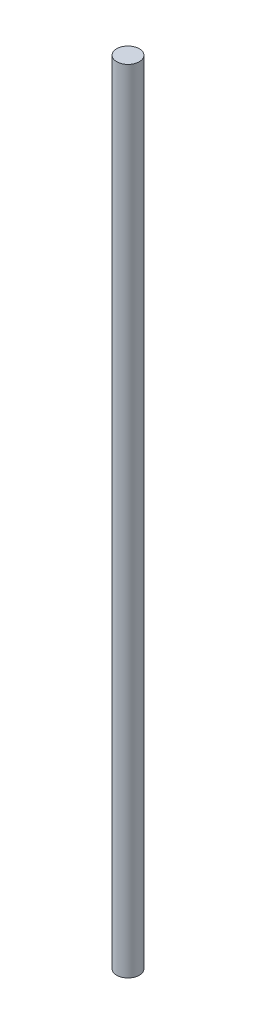
from build123d import *

# Parameters (mm, degrees)
SKETCH2_R           = 4
BOSS_EXTRUDE1_DEPTH = 280.6


with BuildPart() as part:
    # Sketch2 → Boss-Extrude1 (new body)
    with BuildSketch(Plane(origin=(0, 0, 0), x_dir=(1, 0, 0), z_dir=(0, 1, 0))):
        with Locations(Location((0, 0, 0), (0, 0, 270))):
            Circle(SKETCH2_R)
    extrude(amount=BOSS_EXTRUDE1_DEPTH)


solid = part.part
